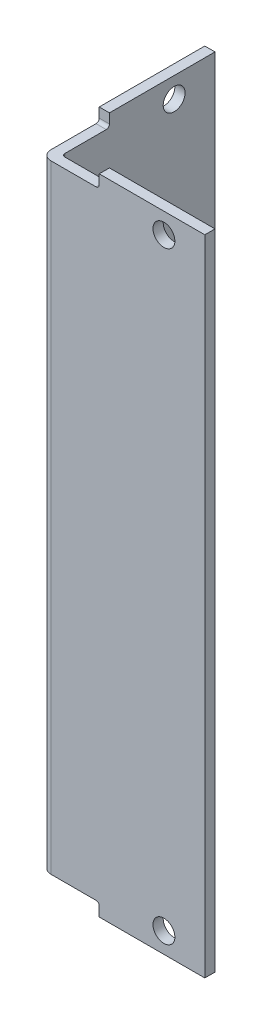
from build123d import *

# Parameters (mm, degrees)
SKETCH1_W             = 25.4
SKETCH1_H             = 25.4
BOSS_EXTRUDE1_DEPTH   = 56.75
SKETCH2_W             = 23.8125
SKETCH2_H             = 23.8125
CUT_EXTRUDE1_DEPTH    = 115.912270885
FILLET1_R             = 0.508
M3_CLEARANCE_HOLE1_D  = 3.4
M3_CLEARANCE_HOLE2_D  = 3.4
M3_CLEARANCE_HOLE3_D  = 3.4
M3_CLEARANCE_HOLE4_D  = 3.4
FILLET2_R             = 1.5
CUT_EXTRUDE2_REACH    = 65.459
SKETCH11_W            = 16.9
SKETCH11_H            = 6.499999954
SKETCH11_H_2          = 7
CUT_EXTRUDE3_REACH    = 65.459
SKETCH12_W            = 16.9
SKETCH12_H            = 6.5
SKETCH12_H_2          = 7
FILLET3_R             = 3.81
CUT_EXTRUDE4_REACH    = 65.459
SKETCH13_W            = 15.4
SKETCH13_H            = 87.3
CUT_EXTRUDE5_REACH    = 65.459
SKETCH14_W            = 15.4
SKETCH14_H            = 87.3
CHAMFER2_SIZE         = 6.35
FILLET5_R             = 3.81
SKETCH15_W            = 12.31
SKETCH15_H            = 12.31
CUT_EXTRUDE6_DEPTH    = 6.5
SKETCH17_W            = 12.31
SKETCH17_H            = 12.31
CUT_EXTRUDE8_DEPTH    = 7
BOSS_EXTRUDE2_START   = -1.5875
BOSS_EXTRUDE2_DEPTH   = 1.5875
BOSS_EXTRUDE3_START   = -1.5875
BOSS_EXTRUDE3_DEPTH   = 1.5875
CUT_EXTRUDE12_REACH   = 59.038
SKETCH23_W            = 6.5
SKETCH23_H            = 7
FILLET9_R             = 1.5875
FILLET9_OF_MIRROR3_R  = 1.5875
BOSS_EXTRUDE4_DEPTH   = 1.5875
SKETCH25_W            = 9
SKETCH25_H            = 9
CUT_EXTRUDE13_DEPTH   = 2
FILLET10_R            = 0.5
FILLET10_OF_MIRROR4_R = 0.5


with BuildPart() as part:
    # Sketch1 → Boss-Extrude1 (new, symmetric)
    with BuildSketch(Plane(origin=(0, 0, 0), x_dir=(1, 0, 0), z_dir=(0, 1, 0))):
        Rectangle(SKETCH1_W, SKETCH1_H)
    extrude(amount=BOSS_EXTRUDE1_DEPTH, both=True)

    # Sketch2 → Cut-Extrude1 (cut, through all)
    with BuildSketch(Plane(origin=(0, 56.75, 0), x_dir=(1, 0, 0), z_dir=(0, 1, 0))):
        with Locations((0.79375, 0.79375)):
            Rectangle(SKETCH2_W, SKETCH2_H)
    extrude(amount=-CUT_EXTRUDE1_DEPTH, mode=Mode.SUBTRACT)

    # Fillet1
    fillet1_edges = [part.edges().sort_by_distance(p)[0] for p in [
        (-11.1125, 0, 11.1125),
    ]]
    fillet(fillet1_edges, radius=FILLET1_R)

    # M3 Clearance Hole1 (through all)
    with Locations(Plane.XY.offset(12.7)):
        with Locations((6.35, 47.075)):
            Hole(M3_CLEARANCE_HOLE1_D / 2)

    # M3 Clearance Hole2 (through all)
    with Locations(Plane.ZY.offset(12.7)):
        with Locations((-6.35, 47.075)):
            Hole(M3_CLEARANCE_HOLE2_D / 2)

    # M3 Clearance Hole3 (through all)
    with Locations(Plane.XY.offset(12.7)):
        with Locations((6.35, -46.575)):
            Hole(M3_CLEARANCE_HOLE3_D / 2)

    # M3 Clearance Hole4 (through all)
    with Locations(Plane.ZY.offset(12.7)):
        with Locations((-6.35, -46.575)):
            Hole(M3_CLEARANCE_HOLE4_D / 2)

    # Fillet2
    fillet2_edges = [part.edges().sort_by_distance(p)[0] for p in [
        (-12.7, 0, 12.7),
    ]]
    fillet(fillet2_edges, radius=FILLET2_R)

    # Sketch11 → Cut-Extrude2 (cut, up to next)
    with BuildSketch(Plane.ZY.offset(12.7), mode=Mode.PRIVATE) as cut_extrude2_sk1:
        with Locations((-4.25, 53.500000023)):
            Rectangle(SKETCH11_W, SKETCH11_H)
    cut_extrude2_tool1 = extrude(cut_extrude2_sk1.sketch, amount=-CUT_EXTRUDE2_REACH, mode=Mode.PRIVATE) & part.part
    # Sketch11 → Cut-Extrude2 (cut, up to next)
    with BuildSketch(Plane.ZY.offset(12.7), mode=Mode.PRIVATE) as cut_extrude2_sk2:
        with Locations((-4.25, -53.25)):
            Rectangle(SKETCH11_W, SKETCH11_H_2)
    cut_extrude2_tool2 = extrude(cut_extrude2_sk2.sketch, amount=-CUT_EXTRUDE2_REACH, mode=Mode.PRIVATE) & part.part
    add(cut_extrude2_tool1.solids().sort_by_distance((-12.7, 53.5, -4.25))[0], mode=Mode.SUBTRACT)
    add(cut_extrude2_tool2.solids().sort_by_distance((-12.7, -53.25, -4.25))[0], mode=Mode.SUBTRACT)

    # Sketch12 → Cut-Extrude3 (cut, up to next)
    with BuildSketch(Plane.XY.offset(12.7), mode=Mode.PRIVATE) as cut_extrude3_sk1:
        with Locations((4.25, 53.5)):
            Rectangle(SKETCH12_W, SKETCH12_H)
    cut_extrude3_tool1 = extrude(cut_extrude3_sk1.sketch, amount=-CUT_EXTRUDE3_REACH, mode=Mode.PRIVATE) & part.part
    # Sketch12 → Cut-Extrude3 (cut, up to next)
    with BuildSketch(Plane.XY.offset(12.7), mode=Mode.PRIVATE) as cut_extrude3_sk2:
        with Locations((4.25, -53.25)):
            Rectangle(SKETCH12_W, SKETCH12_H_2)
    cut_extrude3_tool2 = extrude(cut_extrude3_sk2.sketch, amount=-CUT_EXTRUDE3_REACH, mode=Mode.PRIVATE) & part.part
    add(cut_extrude3_tool1.solids().sort_by_distance((4.25, 53.5, 12.7))[0], mode=Mode.SUBTRACT)
    add(cut_extrude3_tool2.solids().sort_by_distance((4.25, -53.25, 12.7))[0], mode=Mode.SUBTRACT)

    # Fillet3
    fillet3_edges = [part.edges().sort_by_distance(p)[0] for p in [
        (-4.2, 50.25, 11.90625),
        (-4.2, -49.75, 11.90625),
        (-11.90625, 50.250000046, 4.2),
        (-11.90625, -49.75, 4.2),
    ]]
    fillet(fillet3_edges, radius=FILLET3_R)

    # Sketch13 → Cut-Extrude4 (cut, up to next)
    with BuildSketch(Plane.ZY.offset(12.7), mode=Mode.PRIVATE) as cut_extrude4_sk1:
        with Locations((-5, 0.25)):
            Rectangle(SKETCH13_W, SKETCH13_H)
    cut_extrude4_tool1 = extrude(cut_extrude4_sk1.sketch, amount=-CUT_EXTRUDE4_REACH, mode=Mode.PRIVATE) & part.part
    add(cut_extrude4_tool1.solids().sort_by_distance((-12.7, 0.25, -5))[0], mode=Mode.SUBTRACT)

    # Sketch14 → Cut-Extrude5 (cut, up to next)
    with BuildSketch(Plane.XY.offset(12.7), mode=Mode.PRIVATE) as cut_extrude5_sk1:
        with Locations((5, 0.25)):
            Rectangle(SKETCH14_W, SKETCH14_H)
    cut_extrude5_tool1 = extrude(cut_extrude5_sk1.sketch, amount=-CUT_EXTRUDE5_REACH, mode=Mode.PRIVATE) & part.part
    add(cut_extrude5_tool1.solids().sort_by_distance((5, 0.25, 12.7))[0], mode=Mode.SUBTRACT)

    # Chamfer2
    chamfer2_edges = [part.edges().sort_by_distance(p)[0] for p in [
        (-11.90625, 43.9, 2.7),
        (-11.90625, -43.4, 2.7),
        (-2.7, -43.4, 11.90625),
        (-2.7, 43.9, 11.90625),
    ]]
    chamfer(chamfer2_edges, length=CHAMFER2_SIZE)

    # Fillet5
    fillet5_edges = [part.edges().sort_by_distance(p)[0] for p in [
        (-11.90625, 43.9, -3.65),
        (-11.90625, -37.05, 2.7),
        (-11.90625, 37.55, 2.7),
        (-2.7, -37.05, 11.90625),
        (-2.7, 37.55, 11.90625),
        (3.65, 43.9, 11.90625),
        (3.65, -43.4, 11.90625),
        (-11.90625, -43.4, -3.65),
    ]]
    fillet(fillet5_edges, radius=FILLET5_R)

    # Sketch15 → Cut-Extrude6 (cut)
    with BuildSketch(Plane(origin=(0, 56.75, 0), x_dir=(1, 0, 0), z_dir=(0, 1, 0))):
        with Locations((-6.545, -6.545)):
            Rectangle(SKETCH15_W, SKETCH15_H)
    extrude(amount=-CUT_EXTRUDE6_DEPTH, mode=Mode.SUBTRACT)

    # Sketch17 → Cut-Extrude8 (cut)
    with BuildSketch(Plane.XZ.offset(56.75)):
        with Locations((-6.545, 6.545)):
            Rectangle(SKETCH17_W, SKETCH17_H)
    extrude(amount=-CUT_EXTRUDE8_DEPTH, mode=Mode.SUBTRACT)

    # Sketch20 → Boss-Extrude2 (add)
    with BuildSketch(Plane.ZY.offset(12.7).offset(BOSS_EXTRUDE2_START)):
        with BuildLine():
            Line((-12.7, 43.9), (-12.7, -43.4))
            Line((-12.7, -43.4), (-5.228153673, -43.4))
            ThreePointArc((-5.228153673, -43.4), (-3.770129795, -43.109981019), (-2.534076836, -42.284076836))
            Line((-2.534076836, -42.284076836), (1.584076836, -38.165923164))
            ThreePointArc((1.584076836, -38.165923164), (2.409981019, -36.929870205), (2.7, -35.471846327))
            Line((2.7, -35.471846327), (2.7, 35.971846327))
            ThreePointArc((2.7, 35.971846327), (2.409981019, 37.429870205), (1.584076836, 38.665923164))
            Line((1.584076836, 38.665923164), (-2.534076836, 42.784076836))
            ThreePointArc((-2.534076836, 42.784076836), (-3.770129795, 43.609981019), (-5.228153673, 43.9))
            Line((-5.228153673, 43.9), (-12.7, 43.9))
        make_face()
    extrude(amount=BOSS_EXTRUDE2_DEPTH)

    # Sketch21 → Boss-Extrude3 (add)
    with BuildSketch(Plane.XY.offset(12.7).offset(BOSS_EXTRUDE3_START)):
        with BuildLine():
            Line((12.7, 43.9), (12.7, -43.4))
            Line((12.7, -43.4), (5.228153673, -43.4))
            ThreePointArc((5.228153673, -43.4), (3.770129795, -43.109981019), (2.534076836, -42.284076836))
            Line((2.534076836, -42.284076836), (-1.584076836, -38.165923164))
            ThreePointArc((-1.584076836, -38.165923164), (-2.409981019, -36.929870205), (-2.7, -35.471846327))
            Line((-2.7, -35.471846327), (-2.7, 35.971846327))
            ThreePointArc((-2.7, 35.971846327), (-2.409981019, 37.429870205), (-1.584076836, 38.665923164))
            Line((-1.584076836, 38.665923164), (2.534076836, 42.784076836))
            ThreePointArc((2.534076836, 42.784076836), (3.770129795, 43.609981019), (5.228153673, 43.9))
            Line((5.228153673, 43.9), (12.7, 43.9))
        make_face()
    extrude(amount=BOSS_EXTRUDE3_DEPTH)

    # Sketch23 → Cut-Extrude12 (cut, up to next)
    with BuildSketch(Plane(origin=(-11.1125, 0, 0), x_dir=(0, 0, -1), z_dir=(1, 0, 0)), mode=Mode.PRIVATE) as cut_extrude12_sk1:
        with Locations((-5.8625, 37.75)):
            Rectangle(SKETCH23_W, SKETCH23_H)
    cut_extrude12_tool1 = extrude(cut_extrude12_sk1.sketch, amount=-CUT_EXTRUDE12_REACH, mode=Mode.PRIVATE) & part.part
    cut_extrude12 = cut_extrude12_tool1.solids().sort_by_distance((-11.1125, 37.75, 5.8625))[0]
    add(cut_extrude12, mode=Mode.SUBTRACT)

    # Fillet9
    fillet9_edges = [part.edges().sort_by_distance(p)[0] for p in [
        (-11.90625, 41.25, 9.1125),
        (-11.90625, 41.25, 2.6125),
        (-11.90625, 34.25, 2.6125),
        (-11.90625, 34.25, 9.1125),
    ]]
    fillet(fillet9_edges, radius=FILLET9_R)

    # Mirror3: Cut-Extrude12 across plane
    add(cut_extrude12.mirror(Plane.ZX.offset(0.250000023)), mode=Mode.SUBTRACT)

    # Fillet9 of Mirror3
    fillet9_of_mirror3_edges = [part.edges().sort_by_distance(p)[0] for p in [
        (-11.90625, -40.749999954, 9.1125),
        (-11.90625, -40.749999954, 2.6125),
        (-11.90625, -33.749999954, 2.6125),
        (-11.90625, -33.749999954, 9.1125),
    ]]
    fillet(fillet9_of_mirror3_edges, radius=FILLET9_OF_MIRROR3_R)

    # Sketch24 → Boss-Extrude4 (add)
    with BuildSketch(Plane.ZY.offset(12.7)):
        with BuildLine():
            Line((4.2, 34.25), (7.525, 34.25))
            ThreePointArc((7.525, 34.25), (8.647532015, 34.714967985), (9.1125, 35.8375))
            Line((9.1125, 35.8375), (9.1125, 39.6625))
            ThreePointArc((9.1125, 39.6625), (8.647532015, 40.785032015), (7.525, 41.25))
            Line((7.525, 41.25), (4.2, 41.25))
            ThreePointArc((4.2, 41.25), (3.077467985, 40.785032015), (2.6125, 39.6625))
            Line((2.6125, 39.6625), (2.6125, 35.8375))
            ThreePointArc((2.6125, 35.8375), (3.077467985, 34.714967985), (4.2, 34.25))
        make_face()
    extrude(amount=-BOSS_EXTRUDE4_DEPTH)

    # Sketch25 → Cut-Extrude13 (cut)
    with BuildSketch(Plane.XZ.offset(49.75)):
        with Locations((-8.2, 8.2)):
            Rectangle(SKETCH25_W, SKETCH25_H)
    cut_extrude13 = extrude(amount=-CUT_EXTRUDE13_DEPTH, mode=Mode.SUBTRACT)

    # Fillet10
    fillet10_edges = [part.edges().sort_by_distance(p)[0] for p in [
        (-3.7, -47.75, 11.90625),
        (-11.90625, -47.75, 3.7),
    ]]
    fillet(fillet10_edges, radius=FILLET10_R)

    # Mirror4: Cut-Extrude13 across plane
    add(cut_extrude13.mirror(Plane.ZX.offset(0.250000023)), mode=Mode.SUBTRACT)

    # Fillet10 of Mirror4
    fillet10_of_mirror4_edges = [part.edges().sort_by_distance(p)[0] for p in [
        (-3.7, 48.250000046, 11.90625),
        (-11.90625, 48.250000046, 3.7),
    ]]
    fillet(fillet10_of_mirror4_edges, radius=FILLET10_OF_MIRROR4_R)


solid = part.part
